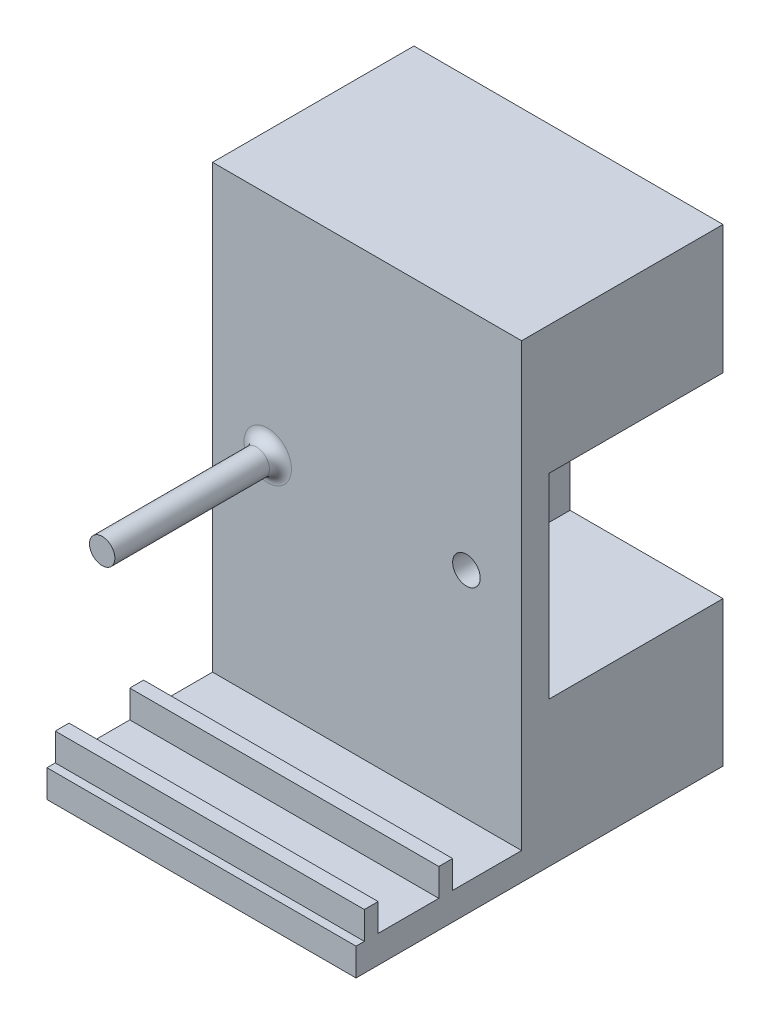
from build123d import *

# Parameters (mm, degrees)
SKETCH1_W                = 71.12
SKETCH1_H                = 101.6
BOSS_EXTRUDE1_DEPTH      = 6.35
SKETCH2_R                = 3.175
CUT_EXTRUDE2_DEPTH       = 6.35
BOSS_EXTRUDE2_DEPTH      = 40
SKETCH4_R                = 2.921
BOSS_EXTRUDE4_DEPTH      = 38.1
FILLET1_R                = 2.54
BOSS_EXTRUDE5_DEPTH      = 38.1
BOSS_EXTRUDE5_DEPTH_BACK = 46.35
SKETCH5_W                = 71.12
SKETCH5_H                = 6.35
SKETCH8_W                = 71.12
SKETCH8_H                = 3.175
BOSS_EXTRUDE6_DEPTH      = 6.35


with BuildPart() as part:
    # Sketch1 → Boss-Extrude1 (new body)
    with BuildSketch(Plane.XY):
        Rectangle(SKETCH1_W, SKETCH1_H)
    extrude(amount=BOSS_EXTRUDE1_DEPTH)

    # Sketch2 → Cut-Extrude2 (cut)
    with BuildSketch(Plane.XY.offset(6.35)):
        with Locations((22.86, -1.27)):
            Circle(SKETCH2_R)
    extrude(amount=-CUT_EXTRUDE2_DEPTH, mode=Mode.SUBTRACT)

    # Sketch6 → Boss-Extrude2 (add)
    with BuildSketch(Plane(origin=(0, 0, 0), x_dir=(-1, 0, 0), z_dir=(0, 0, -1))):
        Polygon((-35.56, 50.8), (-35.56, 21.23), (-0.36, 21.23), (-0.36, -23.77), (-35.56, -23.77), (-35.56, -50.8), (35.56, -50.8), (35.56, 50.8), align=None)
    extrude(amount=BOSS_EXTRUDE2_DEPTH)

    # Sketch4 → Boss-Extrude4 (add)
    with BuildSketch(Plane.XY.offset(6.35)):
        with Locations(Location((-22.86, -1.27, 0), (0, 0, 180))):
            Circle(SKETCH4_R)
    extrude(amount=BOSS_EXTRUDE4_DEPTH)

    # Fillet1
    fillet1_edges = [part.edges().sort_by_distance(p)[0] for p in [
        (-19.939, -1.27, 6.35),
    ]]
    fillet(fillet1_edges, radius=FILLET1_R)

    # Sketch5 → Boss-Extrude5 (add, two sides: drawn at the far end of the back side and taken through both)
    with BuildSketch(Plane.XY.offset(6.35).offset(-BOSS_EXTRUDE5_DEPTH_BACK)):
        with Locations((0, -53.975)):
            Rectangle(SKETCH5_W, SKETCH5_H)
    extrude(amount=BOSS_EXTRUDE5_DEPTH + BOSS_EXTRUDE5_DEPTH_BACK)

    # Sketch8 → Boss-Extrude6 (add)
    with BuildSketch(Plane(origin=(0, -50.8, 0), x_dir=(1, 0, 0), z_dir=(0, 1, 0))):
        with Locations((0, -23.8125)):
            Rectangle(SKETCH8_W, SKETCH8_H)
        with Locations((0, -40.9575)):
            Rectangle(SKETCH8_W, SKETCH8_H)
    extrude(amount=BOSS_EXTRUDE6_DEPTH)


solid = part.part
